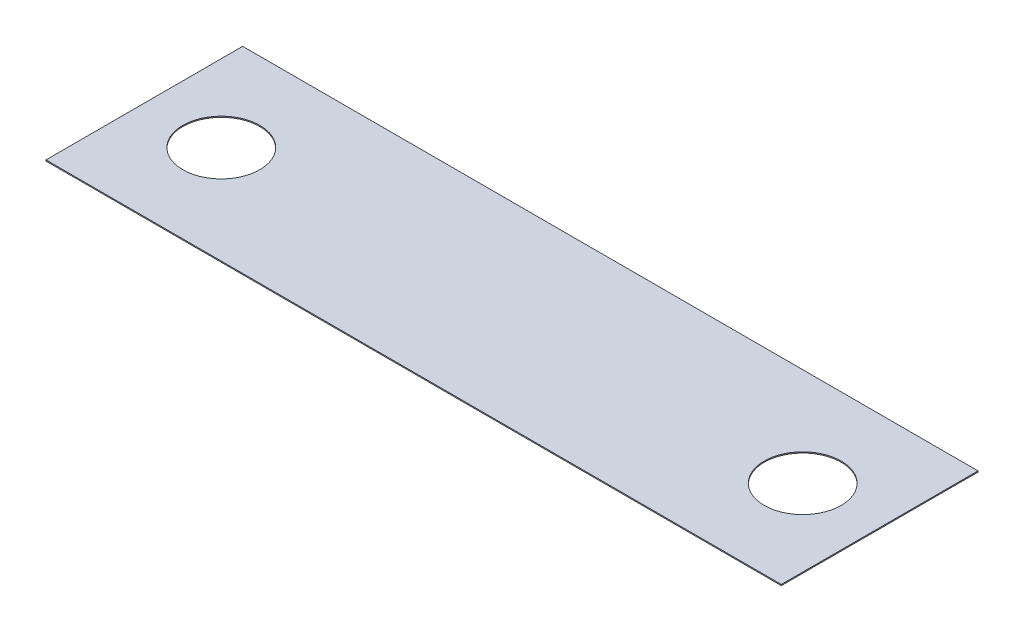
from build123d import *

# Parameters (mm, degrees)
SKETCH1_W                = 86
SKETCH1_H                = 23
EXTRUDE1_DEPTH           = 0.127
F_9_0_9_DIAMETER_HOLE1_D = 9


with BuildPart() as part:
    # Sketch1 → Extrude1 (new body)
    with BuildSketch(Plane(origin=(0, 0, 0), x_dir=(1, 0, 0), z_dir=(0, 1, 0))):
        with Locations((43, 11.5)):
            Rectangle(SKETCH1_W, SKETCH1_H)
    extrude(amount=EXTRUDE1_DEPTH)

    # Ø9.0 (9) Diameter Hole1 (through all)
    with Locations(Plane(origin=(0, 0.127, 0), x_dir=(-1, 0, 0), z_dir=(0, 1, 0))):
        with Locations((-9, -11.5), (-77, -11.5)):
            Hole(F_9_0_9_DIAMETER_HOLE1_D / 2)


solid = part.part
